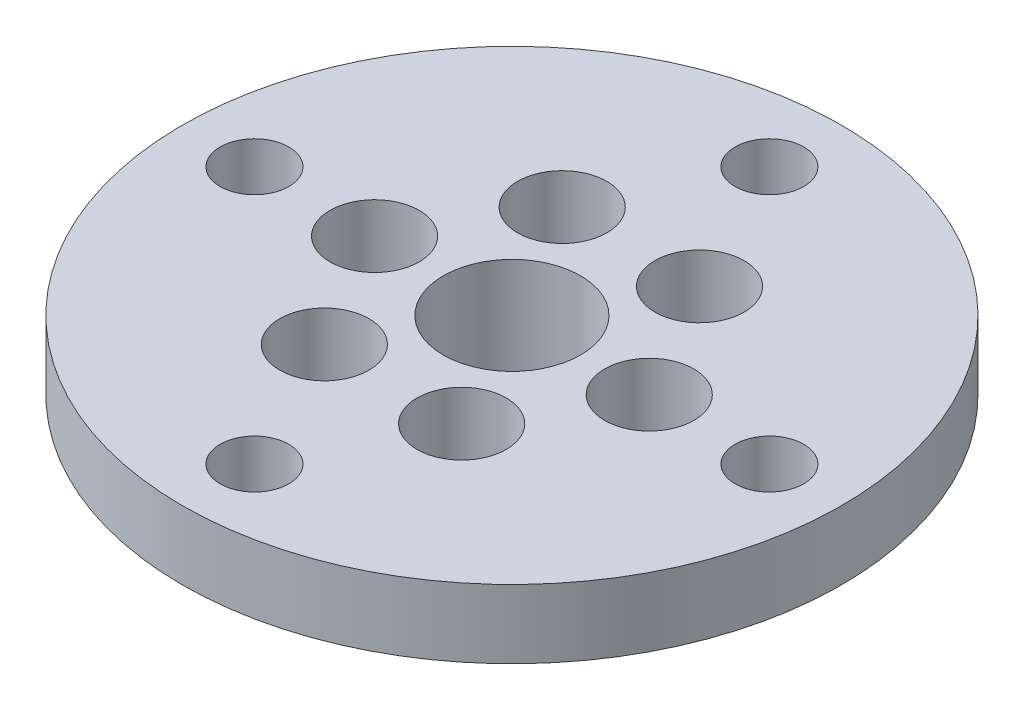
from build123d import *

# Parameters (mm, degrees)
SKETCH1_R           = 15
BOSS_EXTRUDE1_DEPTH = 5
SKETCH3_R           = 24
BOSS_EXTRUDE3_DEPTH = 5
SKETCH2_R           = 1.25
SKETCH2_R_2         = 5
CUT_EXTRUDE1_DEPTH  = 11.5
SKETCH4_R           = 3.25
CUT_EXTRUDE2_DEPTH  = 6
SKETCH5_R           = 2.5
CUT_EXTRUDE3_DEPTH  = 6.5


with BuildPart() as part:
    # Sketch1 → Boss-Extrude1 (new body)
    with BuildSketch(Plane(origin=(0, 0, 0), x_dir=(1, 0, 0), z_dir=(0, 1, 0))):
        with Locations(Location((0, 0, 0), (0, 0, 270))):
            Circle(SKETCH1_R)
    extrude(amount=BOSS_EXTRUDE1_DEPTH)

    # Sketch3 → Boss-Extrude3 (add)
    with BuildSketch(Plane(origin=(0, 5, 0), x_dir=(1, 0, 0), z_dir=(0, 1, 0))):
        with Locations(Location((0, 0, 0), (0, 0, 270))):
            Circle(SKETCH3_R)
    extrude(amount=BOSS_EXTRUDE3_DEPTH)

    # Sketch2 → Cut-Extrude1 (cut)
    with BuildSketch(Plane(origin=(0, 0, 0), x_dir=(1, 0, 0), z_dir=(0, 1, 0))):
        with Locations(Location((-5, 8.660254038, 0), (0, 0, 270))):
            Circle(SKETCH2_R)
        with Locations(Location((5, 8.660254038, 0), (0, 0, 270))):
            Circle(SKETCH2_R)
        with Locations(Location((10, 0, 0), (0, 0, 270))):
            Circle(SKETCH2_R)
        with Locations(Location((5, -8.660254038, 0), (0, 0, 270))):
            Circle(SKETCH2_R)
        with Locations(Location((-5, -8.660254038, 0), (0, 0, 270))):
            Circle(SKETCH2_R)
        with Locations(Location((-10, 0, 0), (0, 0, 270))):
            Circle(SKETCH2_R)
        with Locations(Location((0, 0, 0), (0, 0, 270))):
            Circle(SKETCH2_R_2)
    extrude(amount=CUT_EXTRUDE1_DEPTH, mode=Mode.SUBTRACT)

    # Sketch4 → Cut-Extrude2 (cut)
    with BuildSketch(Plane(origin=(0, 10, 0), x_dir=(1, 0, 0), z_dir=(0, 1, 0))):
        with Locations(Location((10, 0, 0), (0, 0, 270))):
            Circle(SKETCH4_R)
        with Locations(Location((5, 8.660254038, 0), (0, 0, 270))):
            Circle(SKETCH4_R)
        with Locations(Location((5, -8.660254038, 0), (0, 0, 270))):
            Circle(SKETCH4_R)
        with Locations(Location((-5, -8.660254038, 0), (0, 0, 270))):
            Circle(SKETCH4_R)
        with Locations(Location((-10, 0, 0), (0, 0, 270))):
            Circle(SKETCH4_R)
        with Locations(Location((-5, 8.660254038, 0), (0, 0, 270))):
            Circle(SKETCH4_R)
    extrude(amount=-CUT_EXTRUDE2_DEPTH, mode=Mode.SUBTRACT)

    # Sketch5 → Cut-Extrude3 (cut)
    with BuildSketch(Plane(origin=(0, 10, 0), x_dir=(1, 0, 0), z_dir=(0, 1, 0))):
        with Locations(Location((0, 18.75, 0), (0, 0, 270))):
            Circle(SKETCH5_R)
        with Locations(Location((18.75, 0, 0), (0, 0, 270))):
            Circle(SKETCH5_R)
        with Locations(Location((0, -18.75, 0), (0, 0, 270))):
            Circle(SKETCH5_R)
        with Locations(Location((-18.75, 0, 0), (0, 0, 270))):
            Circle(SKETCH5_R)
    extrude(amount=-CUT_EXTRUDE3_DEPTH, mode=Mode.SUBTRACT)


solid = part.part
